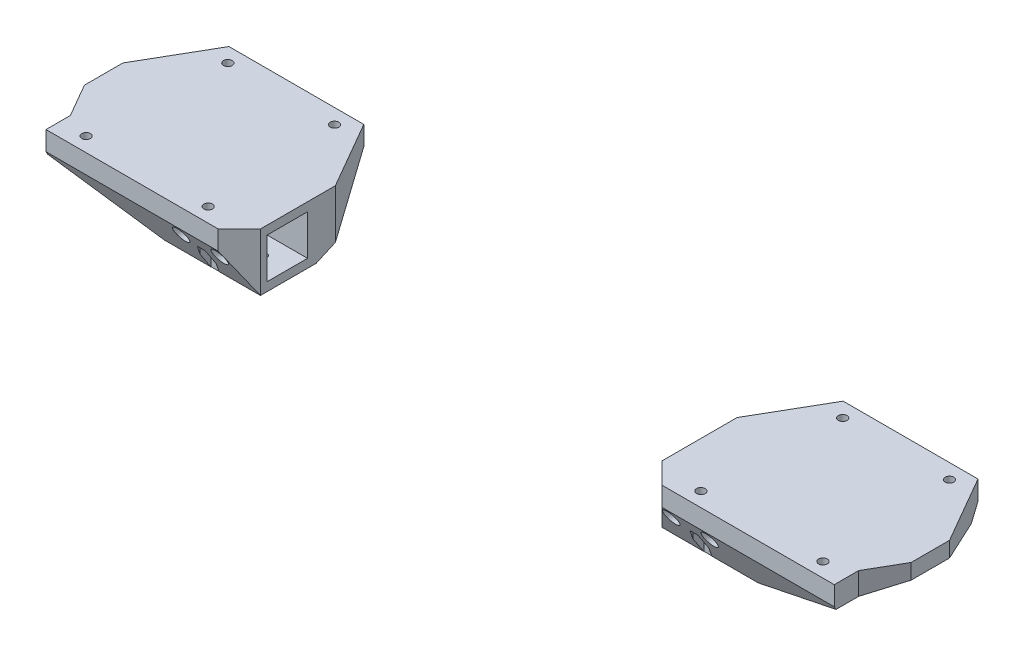
from build123d import *

# Parameters (mm, degrees)
BOSS_EXTRUDE1_DEPTH      = 35
BOSS_EXTRUDE1_DEPTH_BACK = 50
CUT_EXTRUDE1_DEPTH       = 35
CUT_EXTRUDE2_DEPTH       = 215
SKETCH4_W                = 21
SKETCH4_H                = 21
CUT_EXTRUDE3_DEPTH       = 46
SKETCH5_R                = 2.25
CUT_EXTRUDE4_DEPTH       = 46
SKETCH5_4_R              = 2.25
CUT_EXTRUDE5_DEPTH       = 46
SKETCH6_R                = 2.25
CUT_EXTRUDE6_DEPTH       = 10
CUT_EXTRUDE7_DEPTH       = 20
SKETCH7_3_R              = 4
SKETCH7_3_R_2            = 2.25
BOSS_EXTRUDE2_DEPTH      = 5


with BuildPart() as part:
    # Sketch1 → Boss-Extrude1 (new, two sides: drawn at the far end of the back side and taken through both)
    with BuildSketch(Plane.XY.offset(-BOSS_EXTRUDE1_DEPTH_BACK)):
        Polygon((-104.5375, 610), (-215.127563509, 610), (-215.127563509, 602), (-154.5375, 580), (-104.5375, 580), align=None)
    extrude(amount=BOSS_EXTRUDE1_DEPTH + BOSS_EXTRUDE1_DEPTH_BACK)

    # Sketch2 → Cut-Extrude1 (cut)
    with BuildSketch(Plane(origin=(0, 610, 0), x_dir=(1, 0, 0), z_dir=(0, 1, 0))):
        Polygon((-215.127563509, 15), (-194.920304088, 50), (-215.127563509, 50), align=None)
        Polygon((-205.127563509, -22.320508076), (-215.127563509, -5), (-215.127563509, -35), (-205.127563509, -35), align=None)
        Polygon((-115.5375, -35), (-104.5375, -35), (-104.5375, -24), align=None)
        Polygon((-104.5375, 50), (-104.5375, 15), (-124.744759422, 50), align=None)
    extrude(amount=-CUT_EXTRUDE1_DEPTH, mode=Mode.SUBTRACT)

    # Sketch3 → Cut-Extrude2 (cut)
    with BuildSketch(Plane(origin=(0, 0, 0), x_dir=(0, 0, -1), z_dir=(1, 0, 0))):
        Polygon((50, 600), (5, 580), (50, 580), align=None)
        Polygon((-24, 580), (-35, 600), (-35, 580), align=None)
    extrude(amount=-CUT_EXTRUDE2_DEPTH, mode=Mode.SUBTRACT)

    # Sketch4 → Cut-Extrude3 (cut)
    with BuildSketch(Plane(origin=(-104.5375, 0, 0), x_dir=(0, 0, -1), z_dir=(1, 0, 0))):
        with Locations((-10, 595)):
            Rectangle(SKETCH4_W, SKETCH4_H)
    extrude(amount=-CUT_EXTRUDE3_DEPTH, mode=Mode.SUBTRACT)

    # Sketch5 → Cut-Extrude4 (cut)
    # profile 1 of 8: a face of its own
    with BuildSketch(Plane(origin=(0, 600, 0), x_dir=(1, 0, 0), z_dir=(0, 1, 0))):
        Polygon((-134.301963661, 38.674990748), (-130.145041723, 38.674990748), (-128.066580754, 42.274990748), (-130.145041723, 45.874990748), (-134.301963661, 45.874990748), (-136.38042463, 42.274990748), align=None)
        with Locations((-132.223502692, 42.274990748)):
            Circle(SKETCH5_R, mode=Mode.SUBTRACT)
    # profile 2 of 8: a face of its own
    with BuildSketch(Plane(origin=(0, 600, 0), x_dir=(1, 0, 0), z_dir=(0, 1, 0))):
        with Locations((-132.223502692, 42.274990748)):
            Circle(SKETCH5_R)
    # profile 3 of 8: a face of its own
    with BuildSketch(Plane(origin=(0, 600, 0), x_dir=(1, 0, 0), z_dir=(0, 1, 0))):
        Polygon((-185.698036339, 45.874990748), (-189.854958277, 45.874990748), (-191.933419246, 42.274990748), (-189.854958277, 38.674990748), (-185.698036339, 38.674990748), (-183.61957537, 42.274990748), align=None)
        with Locations((-187.776497308, 42.274990748)):
            Circle(SKETCH5_R, mode=Mode.SUBTRACT)
    # profile 4 of 8: a face of its own
    with BuildSketch(Plane(origin=(0, 600, 0), x_dir=(1, 0, 0), z_dir=(0, 1, 0))):
        with Locations((-187.776497308, 42.274990748)):
            Circle(SKETCH5_R)
    # profile 5 of 8: a face of its own
    with BuildSketch(Plane(origin=(0, 600, 0), x_dir=(1, 0, 0), z_dir=(0, 1, 0))):
        Polygon((-189.671539031, -23.9), (-193.828460969, -23.9), (-195.906921938, -27.5), (-193.828460969, -31.1), (-189.671539031, -31.1), (-187.593078062, -27.5), align=None)
        with Locations((-191.75, -27.5)):
            Circle(SKETCH5_R, mode=Mode.SUBTRACT)
    # profile 6 of 8: a face of its own
    with BuildSketch(Plane(origin=(0, 600, 0), x_dir=(1, 0, 0), z_dir=(0, 1, 0))):
        with Locations((-191.75, -27.5)):
            Circle(SKETCH5_R)
    # profile 7 of 8: a face of its own
    with BuildSketch(Plane(origin=(0, 600, 0), x_dir=(1, 0, 0), z_dir=(0, 1, 0))):
        Polygon((-126.171539031, -23.9), (-130.328460969, -23.9), (-132.406921938, -27.5), (-130.328460969, -31.1), (-126.171539031, -31.1), (-124.093078062, -27.5), align=None)
        with Locations((-128.25, -27.5)):
            Circle(SKETCH5_R, mode=Mode.SUBTRACT)
    # profile 8 of 8: a face of its own
    with BuildSketch(Plane(origin=(0, 600, 0), x_dir=(1, 0, 0), z_dir=(0, 1, 0))):
        with Locations((-128.25, -27.5)):
            Circle(SKETCH5_R)
    extrude(amount=-CUT_EXTRUDE4_DEPTH, mode=Mode.SUBTRACT)

    # Sketch5<4> → Cut-Extrude5 (cut)
    with BuildSketch(Plane(origin=(0, 600, 0), x_dir=(1, 0, 0), z_dir=(0, 1, 0))):
        with Locations(Location((-132.223502692, 42.274990748, 0), (0, 0, 180))):
            Circle(SKETCH5_4_R)
        with Locations(Location((-187.776497308, 42.274990748, 0), (0, 0, 180))):
            Circle(SKETCH5_4_R)
        with Locations(Location((-191.75, -27.5, 0), (0, 0, 180))):
            Circle(SKETCH5_4_R)
        with Locations(Location((-128.25, -27.5, 0), (0, 0, 180))):
            Circle(SKETCH5_4_R)
    extrude(amount=CUT_EXTRUDE5_DEPTH, mode=Mode.SUBTRACT)

    # Sketch6 → Cut-Extrude6 (cut)
    with BuildSketch(Plane(origin=(0, 584.5, 0), x_dir=(1, 0, 0), z_dir=(0, 1, 0))):
        with Locations(Location((-137.5375, -10, 0), (0, 0, 270))):
            Circle(SKETCH6_R)
        with Locations(Location((-117.5375, -10, 0), (0, 0, 270))):
            Circle(SKETCH6_R)
    extrude(amount=-CUT_EXTRUDE6_DEPTH, mode=Mode.SUBTRACT)

    # Sketch7 → Cut-Extrude7 (cut)
    with BuildSketch(Plane(origin=(0, 0, 20.5), x_dir=(-1, 0, 0), z_dir=(0, 0, -1))):
        with BuildLine():
            ThreePointArc((115.2875, 595), (117.5375, 592.75), (119.7875, 595))
            Line((119.7875, 595), (117.5375, 595))
            Line((117.5375, 595), (115.2875, 595))
        make_face()
        with BuildLine():
            Line((117.5375, 595), (119.7875, 595))
            ThreePointArc((119.7875, 595), (117.5375, 597.25), (115.2875, 595))
            Line((115.2875, 595), (117.5375, 595))
        make_face()
        with BuildLine():
            ThreePointArc((113.5375, 595), (117.5375, 591), (121.5375, 595))
            Line((121.5375, 595), (119.7875, 595))
            ThreePointArc((119.7875, 595), (117.5375, 592.75), (115.2875, 595))
            Line((115.2875, 595), (113.5375, 595))
        make_face()
        with BuildLine():
            Line((119.7875, 595), (121.5375, 595))
            ThreePointArc((121.5375, 595), (117.5375, 599), (113.5375, 595))
            Line((113.5375, 595), (115.2875, 595))
            ThreePointArc((115.2875, 595), (117.5375, 597.25), (119.7875, 595))
        make_face()
        with BuildLine():
            ThreePointArc((135.2875, 595), (137.5375, 592.75), (139.7875, 595))
            Line((139.7875, 595), (137.5375, 595))
            Line((137.5375, 595), (135.2875, 595))
        make_face()
        with BuildLine():
            Line((137.5375, 595), (139.7875, 595))
            ThreePointArc((139.7875, 595), (137.5375, 597.25), (135.2875, 595))
            Line((135.2875, 595), (137.5375, 595))
        make_face()
        with BuildLine():
            ThreePointArc((133.5375, 595), (137.5375, 591), (141.5375, 595))
            Line((141.5375, 595), (139.7875, 595))
            ThreePointArc((139.7875, 595), (137.5375, 592.75), (135.2875, 595))
            Line((135.2875, 595), (133.5375, 595))
        make_face()
        with BuildLine():
            Line((139.7875, 595), (141.5375, 595))
            ThreePointArc((141.5375, 595), (137.5375, 599), (133.5375, 595))
            Line((133.5375, 595), (135.2875, 595))
            ThreePointArc((135.2875, 595), (137.5375, 597.25), (139.7875, 595))
        make_face()
    extrude(amount=-CUT_EXTRUDE7_DEPTH, mode=Mode.SUBTRACT)

    # Sketch7<3> → Boss-Extrude2 (add)
    # profile 1 of 2: a face of its own
    with BuildSketch(Plane(origin=(0, 0, 20.5), x_dir=(-1, 0, 0), z_dir=(0, 0, -1))):
        with Locations((117.5375, 595)):
            Circle(SKETCH7_3_R)
        with Locations((117.5375, 595)):
            Circle(SKETCH7_3_R_2, mode=Mode.SUBTRACT)
    # profile 2 of 2: a face of its own
    with BuildSketch(Plane(origin=(0, 0, 20.5), x_dir=(-1, 0, 0), z_dir=(0, 0, -1))):
        with Locations((137.5375, 595)):
            Circle(SKETCH7_3_R)
        with Locations((137.5375, 595)):
            Circle(SKETCH7_3_R_2, mode=Mode.SUBTRACT)
    extrude(amount=-BOSS_EXTRUDE2_DEPTH)


with BuildPart() as body_2:
    # Mirror2: mirrored copy
    add(part.part.mirror(Plane(origin=(-0.0375, 0, 0), x_dir=(0, 0, 1), z_dir=(1, 0, 0))))


solid = Compound([part.part, body_2.part])
